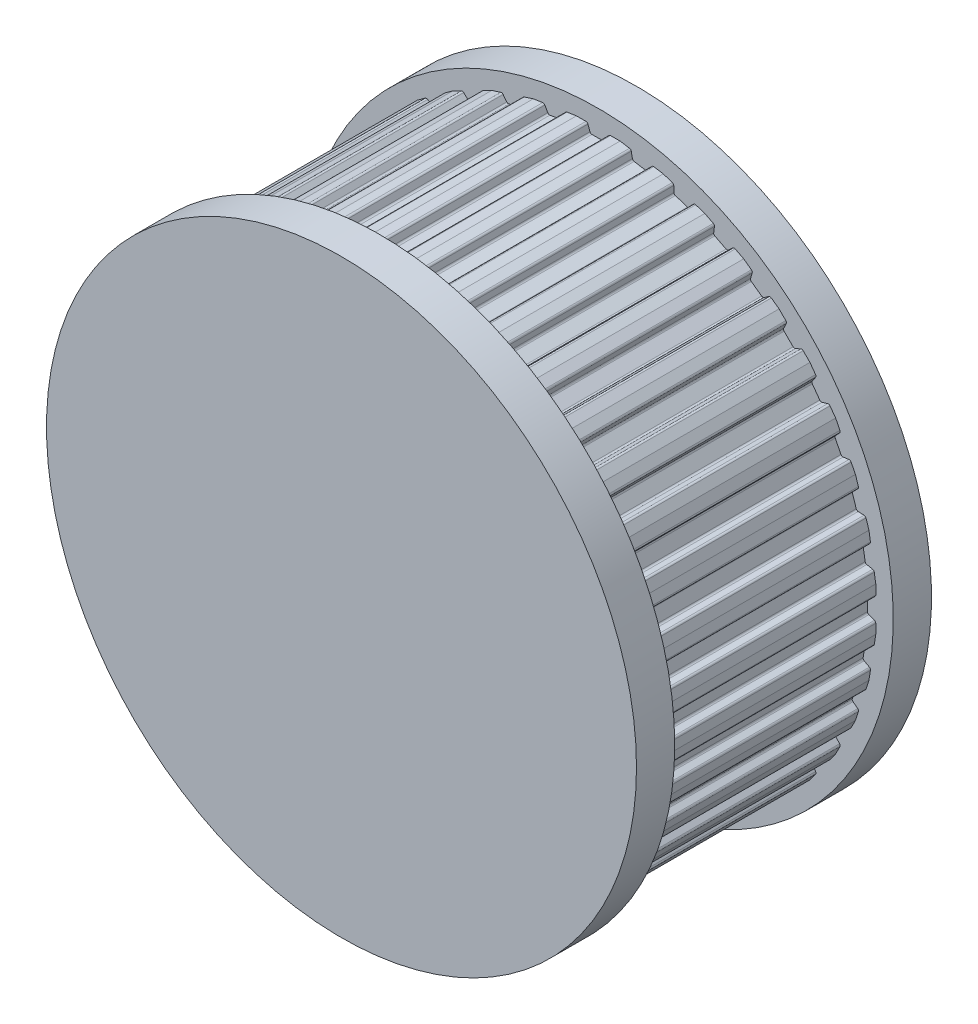
from build123d import *

# Parameters (mm, degrees)
BOSS_EXTRUDE1_DEPTH = 10
SKETCH3_R           = 13.5
BOSS_EXTRUDE2_DEPTH = 1.75
BOSS_EXTRUDE3_START = 1.75
SKETCH4_R           = 13.5
BOSS_EXTRUDE3_DEPTH = 1.75


with BuildPart() as part:
    # Sketch1 → Boss-Extrude1 (new body)
    with BuildSketch(Plane.XY):
        with BuildLine():
            Line((-50.783511677, 0), (-50.346633156, 0))
            ThreePointArc((-50.346633156, 0), (-50.292, 0.017225768), (-50.257127433, 0.062672581))
            Line((-50.257127433, 0.062672581), (-50.164076682, 0.318327419))
            ThreePointArc((-50.164076682, 0.318327419), (-50.129204116, 0.363774232), (-50.07457096, 0.381))
            Line((-50.07457096, 0.381), (-49.49342904, 0.381))
            ThreePointArc((-49.49342904, 0.381), (-49.438795884, 0.363774232), (-49.403923318, 0.318327419))
            Line((-49.403923318, 0.318327419), (-49.310872567, 0.062672581))
            ThreePointArc((-49.310872567, 0.062672581), (-49.276, 0.017225768), (-49.221366844, 0))
            Line((-49.221366844, 0), (-48.784488323, 0))
            Line((-48.784488323, 0), (-48.352988502, 0.068342858))
            ThreePointArc((-48.352988502, 0.068342858), (-48.301722675, 0.093903056), (-48.274388895, 0.144245615))
            Line((-48.274388895, 0.144245615), (-48.222476981, 0.411309262))
            ThreePointArc((-48.222476981, 0.411309262), (-48.195143202, 0.461651821), (-48.143877375, 0.487212019))
            Line((-48.143877375, 0.487212019), (-47.569890276, 0.578122645))
            ThreePointArc((-47.569890276, 0.578122645), (-47.513235041, 0.569655463), (-47.471682366, 0.530223447))
            Line((-47.471682366, 0.530223447), (-47.339783996, 0.292272489))
            ThreePointArc((-47.339783996, 0.292272489), (-47.298231321, 0.252840473), (-47.241576086, 0.244373291))
            Line((-47.241576086, 0.244373291), (-46.810076265, 0.312716149))
            Line((-46.810076265, 0.312716149), (-46.3945801, 0.447719036))
            ThreePointArc((-46.3945801, 0.447719036), (-46.347943937, 0.480984289), (-46.328821993, 0.534982993))
            Line((-46.328821993, 0.534982993), (-46.319327159, 0.806879455))
            ThreePointArc((-46.319327159, 0.806879455), (-46.300205215, 0.860878159), (-46.253569052, 0.894143411))
            Line((-46.253569052, 0.894143411), (-45.700870241, 1.073726141))
            ThreePointArc((-45.700870241, 1.073726141), (-45.643587967, 1.074226035), (-45.596378348, 1.041779763))
            Line((-45.596378348, 1.041779763), (-45.428880136, 0.827391827))
            ThreePointArc((-45.428880136, 0.827391827), (-45.381670516, 0.794945555), (-45.324388243, 0.79544545))
            Line((-45.324388243, 0.79544545), (-44.908892078, 0.930448337))
            Line((-44.908892078, 0.930448337), (-44.519630466, 1.128787035))
            ThreePointArc((-44.519630466, 1.128787035), (-44.478772303, 1.16893824), (-44.46833304, 1.225263462))
            Line((-44.46833304, 1.225263462), (-44.501489081, 1.495297747))
            ThreePointArc((-44.501489081, 1.495297747), (-44.491049818, 1.551622968), (-44.450191655, 1.591774173))
            Line((-44.450191655, 1.591774173), (-43.932390412, 1.855607084))
            ThreePointArc((-43.932390412, 1.855607084), (-43.875891579, 1.865061746), (-43.824187473, 1.840400153))
            Line((-43.824187473, 1.840400153), (-43.62521378, 1.654854182))
            ThreePointArc((-43.62521378, 1.654854182), (-43.573509674, 1.630192588), (-43.517010841, 1.63964725))
            Line((-43.517010841, 1.63964725), (-43.127749228, 1.837985948))
            Line((-43.127749228, 1.837985948), (-42.77430708, 2.0947767))
            ThreePointArc((-42.77430708, 2.0947767), (-42.740232981, 2.140825202), (-42.738733449, 2.198090027))
            Line((-42.738733449, 2.198090027), (-42.813723953, 2.459612994))
            ThreePointArc((-42.813723953, 2.459612994), (-42.812224421, 2.516877819), (-42.778150322, 2.562926321))
            Line((-42.778150322, 2.562926321), (-42.307996632, 2.904512971))
            ThreePointArc((-42.307996632, 2.904512971), (-42.253672429, 2.922689596), (-42.198746963, 2.906419932))
            Line((-42.198746963, 2.906419932), (-41.973197181, 2.754284683))
            ThreePointArc((-41.973197181, 2.754284683), (-41.918271715, 2.738015018), (-41.863947511, 2.756191643))
            Line((-41.863947511, 2.756191643), (-41.510505363, 3.012982394))
            Line((-41.510505363, 3.012982394), (-41.201585599, 3.321902159))
            ThreePointArc((-41.201585599, 3.321902159), (-41.175134581, 3.372714091), (-41.182611703, 3.42950847))
            Line((-41.182611703, 3.42950847), (-41.297590155, 3.676080556))
            ThreePointArc((-41.297590155, 3.676080556), (-41.305067277, 3.732874934), (-41.278616259, 3.783686866))
            Line((-41.278616259, 3.783686866), (-40.867686866, 4.194616259))
            ThreePointArc((-40.867686866, 4.194616259), (-40.816874934, 4.221067277), (-40.760080556, 4.213590155))
            Line((-40.760080556, 4.213590155), (-40.51350847, 4.098611703))
            ThreePointArc((-40.51350847, 4.098611703), (-40.456714091, 4.091134581), (-40.405902159, 4.117585599))
            Line((-40.405902159, 4.117585599), (-40.096982394, 4.426505363))
            Line((-40.096982394, 4.426505363), (-39.840191643, 4.779947511))
            ThreePointArc((-39.840191643, 4.779947511), (-39.822015018, 4.834271715), (-39.838284683, 4.889197181))
            Line((-39.838284683, 4.889197181), (-39.990419932, 5.114746963))
            ThreePointArc((-39.990419932, 5.114746963), (-40.006689596, 5.169672429), (-39.988512971, 5.223996632))
            Line((-39.988512971, 5.223996632), (-39.646926321, 5.694150322))
            ThreePointArc((-39.646926321, 5.694150322), (-39.600877819, 5.728224421), (-39.543612994, 5.729723953))
            Line((-39.543612994, 5.729723953), (-39.282090027, 5.654733449))
            ThreePointArc((-39.282090027, 5.654733449), (-39.224825202, 5.656232981), (-39.1787767, 5.69030708))
            Line((-39.1787767, 5.69030708), (-38.921985948, 6.043749228))
            Line((-38.921985948, 6.043749228), (-38.72364725, 6.433010841))
            ThreePointArc((-38.72364725, 6.433010841), (-38.714192588, 6.489509674), (-38.738854182, 6.54121378))
            Line((-38.738854182, 6.54121378), (-38.924400153, 6.740187473))
            ThreePointArc((-38.924400153, 6.740187473), (-38.949061746, 6.791891579), (-38.939607084, 6.848390412))
            Line((-38.939607084, 6.848390412), (-38.675774173, 7.366191655))
            ThreePointArc((-38.675774173, 7.366191655), (-38.635622968, 7.407049818), (-38.579297747, 7.417489081))
            Line((-38.579297747, 7.417489081), (-38.309263462, 7.38433304))
            ThreePointArc((-38.309263462, 7.38433304), (-38.25293824, 7.394772303), (-38.212787035, 7.435630466))
            Line((-38.212787035, 7.435630466), (-38.014448337, 7.824892078))
            Line((-38.014448337, 7.824892078), (-37.87944545, 8.240388243))
            ThreePointArc((-37.87944545, 8.240388243), (-37.878945555, 8.297670516), (-37.911391827, 8.344880136))
            Line((-37.911391827, 8.344880136), (-38.125779763, 8.512378348))
            ThreePointArc((-38.125779763, 8.512378348), (-38.158226035, 8.559587967), (-38.157726141, 8.616870241))
            Line((-38.157726141, 8.616870241), (-37.978143411, 9.169569052))
            ThreePointArc((-37.978143411, 9.169569052), (-37.944878159, 9.216205215), (-37.890879455, 9.235327159))
            Line((-37.890879455, 9.235327159), (-37.618982993, 9.244821993))
            ThreePointArc((-37.618982993, 9.244821993), (-37.564984289, 9.263943937), (-37.531719036, 9.3105801))
            Line((-37.531719036, 9.3105801), (-37.396716149, 9.726076265))
            Line((-37.396716149, 9.726076265), (-37.328373291, 10.157576086))
            ThreePointArc((-37.328373291, 10.157576086), (-37.336840473, 10.214231321), (-37.376272489, 10.255783996))
            Line((-37.376272489, 10.255783996), (-37.614223447, 10.387682366))
            ThreePointArc((-37.614223447, 10.387682366), (-37.653655463, 10.429235041), (-37.662122645, 10.485890276))
            Line((-37.662122645, 10.485890276), (-37.571212019, 11.059877375))
            ThreePointArc((-37.571212019, 11.059877375), (-37.545651821, 11.111143202), (-37.495309262, 11.138476981))
            Line((-37.495309262, 11.138476981), (-37.228245615, 11.190388895))
            ThreePointArc((-37.228245615, 11.190388895), (-37.177903056, 11.217722675), (-37.152342858, 11.268988502))
            Line((-37.152342858, 11.268988502), (-37.084, 11.700488323))
            Line((-37.084, 11.700488323), (-37.084, 12.137366844))
            ThreePointArc((-37.084, 12.137366844), (-37.101225768, 12.192), (-37.146672581, 12.226872567))
            Line((-37.146672581, 12.226872567), (-37.402327419, 12.319923318))
            ThreePointArc((-37.402327419, 12.319923318), (-37.447774232, 12.354795884), (-37.465, 12.40942904))
            Line((-37.465, 12.40942904), (-37.465, 12.99057096))
            ThreePointArc((-37.465, 12.99057096), (-37.447774232, 13.045204116), (-37.402327419, 13.080076682))
            Line((-37.402327419, 13.080076682), (-37.146672581, 13.173127433))
            ThreePointArc((-37.146672581, 13.173127433), (-37.101225768, 13.208), (-37.084, 13.262633156))
            Line((-37.084, 13.262633156), (-37.084, 13.699511677))
            Line((-37.084, 13.699511677), (-37.152342858, 14.131011498))
            ThreePointArc((-37.152342858, 14.131011498), (-37.177903056, 14.182277325), (-37.228245615, 14.209611105))
            Line((-37.228245615, 14.209611105), (-37.495309262, 14.261523019))
            ThreePointArc((-37.495309262, 14.261523019), (-37.545651821, 14.288856798), (-37.571212019, 14.340122625))
            Line((-37.571212019, 14.340122625), (-37.662122645, 14.914109724))
            ThreePointArc((-37.662122645, 14.914109724), (-37.653655463, 14.970764959), (-37.614223447, 15.012317634))
            Line((-37.614223447, 15.012317634), (-37.376272489, 15.144216004))
            ThreePointArc((-37.376272489, 15.144216004), (-37.336840473, 15.185768679), (-37.328373291, 15.242423914))
            Line((-37.328373291, 15.242423914), (-37.396716149, 15.673923735))
            Line((-37.396716149, 15.673923735), (-37.531719036, 16.0894199))
            ThreePointArc((-37.531719036, 16.0894199), (-37.564984289, 16.136056063), (-37.618982993, 16.155178007))
            Line((-37.618982993, 16.155178007), (-37.890879455, 16.164672841))
            ThreePointArc((-37.890879455, 16.164672841), (-37.944878159, 16.183794785), (-37.978143411, 16.230430948))
            Line((-37.978143411, 16.230430948), (-38.157726141, 16.783129759))
            ThreePointArc((-38.157726141, 16.783129759), (-38.158226035, 16.840412033), (-38.125779763, 16.887621652))
            Line((-38.125779763, 16.887621652), (-37.911391827, 17.055119864))
            ThreePointArc((-37.911391827, 17.055119864), (-37.878945555, 17.102329484), (-37.87944545, 17.159611757))
            Line((-37.87944545, 17.159611757), (-38.014448337, 17.575107922))
            Line((-38.014448337, 17.575107922), (-38.212787035, 17.964369534))
            ThreePointArc((-38.212787035, 17.964369534), (-38.25293824, 18.005227697), (-38.309263462, 18.01566696))
            Line((-38.309263462, 18.01566696), (-38.579297747, 17.982510919))
            ThreePointArc((-38.579297747, 17.982510919), (-38.635622968, 17.992950182), (-38.675774173, 18.033808345))
            Line((-38.675774173, 18.033808345), (-38.939607084, 18.551609588))
            ThreePointArc((-38.939607084, 18.551609588), (-38.949061746, 18.608108421), (-38.924400153, 18.659812527))
            Line((-38.924400153, 18.659812527), (-38.738854182, 18.85878622))
            ThreePointArc((-38.738854182, 18.85878622), (-38.714192588, 18.910490326), (-38.72364725, 18.966989159))
            Line((-38.72364725, 18.966989159), (-38.921985948, 19.356250772))
            Line((-38.921985948, 19.356250772), (-39.1787767, 19.70969292))
            ThreePointArc((-39.1787767, 19.70969292), (-39.224825202, 19.743767019), (-39.282090027, 19.745266551))
            Line((-39.282090027, 19.745266551), (-39.543612994, 19.670276047))
            ThreePointArc((-39.543612994, 19.670276047), (-39.600877819, 19.671775579), (-39.646926321, 19.705849678))
            Line((-39.646926321, 19.705849678), (-39.988512971, 20.176003368))
            ThreePointArc((-39.988512971, 20.176003368), (-40.006689596, 20.230327571), (-39.990419932, 20.285253037))
            Line((-39.990419932, 20.285253037), (-39.838284683, 20.510802819))
            ThreePointArc((-39.838284683, 20.510802819), (-39.822015018, 20.565728285), (-39.840191643, 20.620052489))
            Line((-39.840191643, 20.620052489), (-40.096982394, 20.973494637))
            Line((-40.096982394, 20.973494637), (-40.405902159, 21.282414401))
            ThreePointArc((-40.405902159, 21.282414401), (-40.456714091, 21.308865419), (-40.51350847, 21.301388297))
            Line((-40.51350847, 21.301388297), (-40.760080556, 21.186409845))
            ThreePointArc((-40.760080556, 21.186409845), (-40.816874934, 21.178932723), (-40.867686866, 21.205383741))
            Line((-40.867686866, 21.205383741), (-41.278616259, 21.616313134))
            ThreePointArc((-41.278616259, 21.616313134), (-41.305067277, 21.667125066), (-41.297590155, 21.723919444))
            Line((-41.297590155, 21.723919444), (-41.182611703, 21.97049153))
            ThreePointArc((-41.182611703, 21.97049153), (-41.175134581, 22.027285909), (-41.201585599, 22.078097841))
            Line((-41.201585599, 22.078097841), (-41.510505363, 22.387017606))
            Line((-41.510505363, 22.387017606), (-41.863947511, 22.643808357))
            ThreePointArc((-41.863947511, 22.643808357), (-41.918271715, 22.661984982), (-41.973197181, 22.645715317))
            Line((-41.973197181, 22.645715317), (-42.198746963, 22.493580068))
            ThreePointArc((-42.198746963, 22.493580068), (-42.253672429, 22.477310404), (-42.307996632, 22.495487029))
            Line((-42.307996632, 22.495487029), (-42.778150322, 22.837073679))
            ThreePointArc((-42.778150322, 22.837073679), (-42.812224421, 22.883122181), (-42.813723953, 22.940387006))
            Line((-42.813723953, 22.940387006), (-42.738733449, 23.201909973))
            ThreePointArc((-42.738733449, 23.201909973), (-42.740232981, 23.259174798), (-42.77430708, 23.3052233))
            Line((-42.77430708, 23.3052233), (-43.127749228, 23.562014052))
            Line((-43.127749228, 23.562014052), (-43.517010841, 23.76035275))
            ThreePointArc((-43.517010841, 23.76035275), (-43.573509674, 23.769807412), (-43.62521378, 23.745145818))
            Line((-43.62521378, 23.745145818), (-43.824187473, 23.559599847))
            ThreePointArc((-43.824187473, 23.559599847), (-43.875891579, 23.534938254), (-43.932390412, 23.544392916))
            Line((-43.932390412, 23.544392916), (-44.450191655, 23.808225827))
            ThreePointArc((-44.450191655, 23.808225827), (-44.491049818, 23.848377032), (-44.501489081, 23.904702253))
            Line((-44.501489081, 23.904702253), (-44.46833304, 24.174736538))
            ThreePointArc((-44.46833304, 24.174736538), (-44.478772303, 24.23106176), (-44.519630466, 24.271212965))
            Line((-44.519630466, 24.271212965), (-44.908892078, 24.469551663))
            Line((-44.908892078, 24.469551663), (-45.324388243, 24.60455455))
            ThreePointArc((-45.324388243, 24.60455455), (-45.381670516, 24.605054445), (-45.428880136, 24.572608173))
            Line((-45.428880136, 24.572608173), (-45.596378348, 24.358220237))
            ThreePointArc((-45.596378348, 24.358220237), (-45.643587967, 24.325773965), (-45.700870241, 24.326273859))
            Line((-45.700870241, 24.326273859), (-46.253569052, 24.505856589))
            ThreePointArc((-46.253569052, 24.505856589), (-46.300205215, 24.539121841), (-46.319327159, 24.593120545))
            Line((-46.319327159, 24.593120545), (-46.328821993, 24.865017007))
            ThreePointArc((-46.328821993, 24.865017007), (-46.347943937, 24.919015711), (-46.3945801, 24.952280964))
            Line((-46.3945801, 24.952280964), (-46.810076265, 25.087283851))
            Line((-46.810076265, 25.087283851), (-47.241576086, 25.155626709))
            ThreePointArc((-47.241576086, 25.155626709), (-47.298231321, 25.147159527), (-47.339783996, 25.107727511))
            Line((-47.339783996, 25.107727511), (-47.471682366, 24.869776553))
            ThreePointArc((-47.471682366, 24.869776553), (-47.513235041, 24.830344537), (-47.569890276, 24.821877355))
            Line((-47.569890276, 24.821877355), (-48.143877375, 24.912787981))
            ThreePointArc((-48.143877375, 24.912787981), (-48.195143202, 24.938348179), (-48.222476981, 24.988690738))
            Line((-48.222476981, 24.988690738), (-48.274388895, 25.255754385))
            ThreePointArc((-48.274388895, 25.255754385), (-48.301722675, 25.306096944), (-48.352988502, 25.331657142))
            Line((-48.352988502, 25.331657142), (-48.784488323, 25.4))
            Line((-48.784488323, 25.4), (-49.221366844, 25.4))
            ThreePointArc((-49.221366844, 25.4), (-49.276, 25.382774232), (-49.310872567, 25.337327419))
            Line((-49.310872567, 25.337327419), (-49.403923318, 25.081672581))
            ThreePointArc((-49.403923318, 25.081672581), (-49.438795884, 25.036225768), (-49.49342904, 25.019))
            Line((-49.49342904, 25.019), (-50.07457096, 25.019))
            ThreePointArc((-50.07457096, 25.019), (-50.129204116, 25.036225768), (-50.164076682, 25.081672581))
            Line((-50.164076682, 25.081672581), (-50.257127433, 25.337327419))
            ThreePointArc((-50.257127433, 25.337327419), (-50.292, 25.382774232), (-50.346633156, 25.4))
            Line((-50.346633156, 25.4), (-50.783511677, 25.4))
            Line((-50.783511677, 25.4), (-51.215011498, 25.331657142))
            ThreePointArc((-51.215011498, 25.331657142), (-51.266277325, 25.306096944), (-51.293611105, 25.255754385))
            Line((-51.293611105, 25.255754385), (-51.345523019, 24.988690738))
            ThreePointArc((-51.345523019, 24.988690738), (-51.372856798, 24.938348179), (-51.424122625, 24.912787981))
            Line((-51.424122625, 24.912787981), (-51.998109724, 24.821877355))
            ThreePointArc((-51.998109724, 24.821877355), (-52.054764959, 24.830344537), (-52.096317634, 24.869776553))
            Line((-52.096317634, 24.869776553), (-52.228216004, 25.107727511))
            ThreePointArc((-52.228216004, 25.107727511), (-52.269768679, 25.147159527), (-52.326423914, 25.155626709))
            Line((-52.326423914, 25.155626709), (-52.757923735, 25.087283851))
            Line((-52.757923735, 25.087283851), (-53.1734199, 24.952280964))
            ThreePointArc((-53.1734199, 24.952280964), (-53.220056063, 24.919015711), (-53.239178007, 24.865017007))
            Line((-53.239178007, 24.865017007), (-53.248672841, 24.593120545))
            ThreePointArc((-53.248672841, 24.593120545), (-53.267794785, 24.539121841), (-53.314430948, 24.505856589))
            Line((-53.314430948, 24.505856589), (-53.867129759, 24.326273859))
            ThreePointArc((-53.867129759, 24.326273859), (-53.924412033, 24.325773965), (-53.971621652, 24.358220237))
            Line((-53.971621652, 24.358220237), (-54.139119864, 24.572608173))
            ThreePointArc((-54.139119864, 24.572608173), (-54.186329484, 24.605054445), (-54.243611757, 24.60455455))
            Line((-54.243611757, 24.60455455), (-54.659107922, 24.469551663))
            Line((-54.659107922, 24.469551663), (-55.048369534, 24.271212965))
            ThreePointArc((-55.048369534, 24.271212965), (-55.089227697, 24.23106176), (-55.09966696, 24.174736538))
            Line((-55.09966696, 24.174736538), (-55.066510919, 23.904702253))
            ThreePointArc((-55.066510919, 23.904702253), (-55.076950182, 23.848377032), (-55.117808345, 23.808225827))
            Line((-55.117808345, 23.808225827), (-55.635609588, 23.544392916))
            ThreePointArc((-55.635609588, 23.544392916), (-55.692108421, 23.534938254), (-55.743812527, 23.559599847))
            Line((-55.743812527, 23.559599847), (-55.94278622, 23.745145818))
            ThreePointArc((-55.94278622, 23.745145818), (-55.994490326, 23.769807412), (-56.050989159, 23.76035275))
            Line((-56.050989159, 23.76035275), (-56.440250772, 23.562014052))
            Line((-56.440250772, 23.562014052), (-56.79369292, 23.3052233))
            ThreePointArc((-56.79369292, 23.3052233), (-56.827767019, 23.259174798), (-56.829266551, 23.201909973))
            Line((-56.829266551, 23.201909973), (-56.754276047, 22.940387006))
            ThreePointArc((-56.754276047, 22.940387006), (-56.755775579, 22.883122181), (-56.789849678, 22.837073679))
            Line((-56.789849678, 22.837073679), (-57.260003368, 22.495487029))
            ThreePointArc((-57.260003368, 22.495487029), (-57.314327571, 22.477310404), (-57.369253037, 22.493580068))
            Line((-57.369253037, 22.493580068), (-57.594802819, 22.645715317))
            ThreePointArc((-57.594802819, 22.645715317), (-57.649728285, 22.661984982), (-57.704052489, 22.643808357))
            Line((-57.704052489, 22.643808357), (-58.057494637, 22.387017606))
            Line((-58.057494637, 22.387017606), (-58.366414401, 22.078097841))
            ThreePointArc((-58.366414401, 22.078097841), (-58.392865419, 22.027285909), (-58.385388297, 21.97049153))
            Line((-58.385388297, 21.97049153), (-58.270409845, 21.723919444))
            ThreePointArc((-58.270409845, 21.723919444), (-58.262932723, 21.667125066), (-58.289383741, 21.616313134))
            Line((-58.289383741, 21.616313134), (-58.700313134, 21.205383741))
            ThreePointArc((-58.700313134, 21.205383741), (-58.751125066, 21.178932723), (-58.807919444, 21.186409845))
            Line((-58.807919444, 21.186409845), (-59.05449153, 21.301388297))
            ThreePointArc((-59.05449153, 21.301388297), (-59.111285909, 21.308865419), (-59.162097841, 21.282414401))
            Line((-59.162097841, 21.282414401), (-59.471017606, 20.973494637))
            Line((-59.471017606, 20.973494637), (-59.727808357, 20.620052489))
            ThreePointArc((-59.727808357, 20.620052489), (-59.745984982, 20.565728285), (-59.729715317, 20.510802819))
            Line((-59.729715317, 20.510802819), (-59.577580068, 20.285253037))
            ThreePointArc((-59.577580068, 20.285253037), (-59.561310404, 20.230327571), (-59.579487029, 20.176003368))
            Line((-59.579487029, 20.176003368), (-59.921073679, 19.705849678))
            ThreePointArc((-59.921073679, 19.705849678), (-59.967122181, 19.671775579), (-60.024387006, 19.670276047))
            Line((-60.024387006, 19.670276047), (-60.285909973, 19.745266551))
            ThreePointArc((-60.285909973, 19.745266551), (-60.343174798, 19.743767019), (-60.3892233, 19.70969292))
            Line((-60.3892233, 19.70969292), (-60.646014052, 19.356250772))
            Line((-60.646014052, 19.356250772), (-60.84435275, 18.966989159))
            ThreePointArc((-60.84435275, 18.966989159), (-60.853807412, 18.910490326), (-60.829145818, 18.85878622))
            Line((-60.829145818, 18.85878622), (-60.643599847, 18.659812527))
            ThreePointArc((-60.643599847, 18.659812527), (-60.618938254, 18.608108421), (-60.628392916, 18.551609588))
            Line((-60.628392916, 18.551609588), (-60.892225827, 18.033808345))
            ThreePointArc((-60.892225827, 18.033808345), (-60.932377032, 17.992950182), (-60.988702253, 17.982510919))
            Line((-60.988702253, 17.982510919), (-61.258736538, 18.01566696))
            ThreePointArc((-61.258736538, 18.01566696), (-61.31506176, 18.005227697), (-61.355212965, 17.964369534))
            Line((-61.355212965, 17.964369534), (-61.553551663, 17.575107922))
            Line((-61.553551663, 17.575107922), (-61.68855455, 17.159611757))
            ThreePointArc((-61.68855455, 17.159611757), (-61.689054445, 17.102329484), (-61.656608173, 17.055119864))
            Line((-61.656608173, 17.055119864), (-61.442220237, 16.887621652))
            ThreePointArc((-61.442220237, 16.887621652), (-61.409773965, 16.840412033), (-61.410273859, 16.783129759))
            Line((-61.410273859, 16.783129759), (-61.589856589, 16.230430948))
            ThreePointArc((-61.589856589, 16.230430948), (-61.623121841, 16.183794785), (-61.677120545, 16.164672841))
            Line((-61.677120545, 16.164672841), (-61.949017007, 16.155178007))
            ThreePointArc((-61.949017007, 16.155178007), (-62.003015711, 16.136056063), (-62.036280964, 16.0894199))
            Line((-62.036280964, 16.0894199), (-62.171283851, 15.673923735))
            Line((-62.171283851, 15.673923735), (-62.239626709, 15.242423914))
            ThreePointArc((-62.239626709, 15.242423914), (-62.231159527, 15.185768679), (-62.191727511, 15.144216004))
            Line((-62.191727511, 15.144216004), (-61.953776553, 15.012317634))
            ThreePointArc((-61.953776553, 15.012317634), (-61.914344537, 14.970764959), (-61.905877355, 14.914109724))
            Line((-61.905877355, 14.914109724), (-61.996787981, 14.340122625))
            ThreePointArc((-61.996787981, 14.340122625), (-62.022348179, 14.288856798), (-62.072690738, 14.261523019))
            Line((-62.072690738, 14.261523019), (-62.339754385, 14.209611105))
            ThreePointArc((-62.339754385, 14.209611105), (-62.390096944, 14.182277325), (-62.415657142, 14.131011498))
            Line((-62.415657142, 14.131011498), (-62.484, 13.699511677))
            Line((-62.484, 13.699511677), (-62.484, 13.262633156))
            ThreePointArc((-62.484, 13.262633156), (-62.466774232, 13.208), (-62.421327419, 13.173127433))
            Line((-62.421327419, 13.173127433), (-62.165672581, 13.080076682))
            ThreePointArc((-62.165672581, 13.080076682), (-62.120225768, 13.045204116), (-62.103, 12.99057096))
            Line((-62.103, 12.99057096), (-62.103, 12.40942904))
            ThreePointArc((-62.103, 12.40942904), (-62.120225768, 12.354795884), (-62.165672581, 12.319923318))
            Line((-62.165672581, 12.319923318), (-62.421327419, 12.226872567))
            ThreePointArc((-62.421327419, 12.226872567), (-62.466774232, 12.192), (-62.484, 12.137366844))
            Line((-62.484, 12.137366844), (-62.484, 11.700488323))
            Line((-62.484, 11.700488323), (-62.415657142, 11.268988502))
            ThreePointArc((-62.415657142, 11.268988502), (-62.390096944, 11.217722675), (-62.339754385, 11.190388895))
            Line((-62.339754385, 11.190388895), (-62.072690738, 11.138476981))
            ThreePointArc((-62.072690738, 11.138476981), (-62.022348179, 11.111143202), (-61.996787981, 11.059877375))
            Line((-61.996787981, 11.059877375), (-61.905877355, 10.485890276))
            ThreePointArc((-61.905877355, 10.485890276), (-61.914344537, 10.429235041), (-61.953776553, 10.387682366))
            Line((-61.953776553, 10.387682366), (-62.191727511, 10.255783996))
            ThreePointArc((-62.191727511, 10.255783996), (-62.231159527, 10.214231321), (-62.239626709, 10.157576086))
            Line((-62.239626709, 10.157576086), (-62.171283851, 9.726076265))
            Line((-62.171283851, 9.726076265), (-62.036280964, 9.3105801))
            ThreePointArc((-62.036280964, 9.3105801), (-62.003015711, 9.263943937), (-61.949017007, 9.244821993))
            Line((-61.949017007, 9.244821993), (-61.677120545, 9.235327159))
            ThreePointArc((-61.677120545, 9.235327159), (-61.623121841, 9.216205215), (-61.589856589, 9.169569052))
            Line((-61.589856589, 9.169569052), (-61.410273859, 8.616870241))
            ThreePointArc((-61.410273859, 8.616870241), (-61.409773965, 8.559587967), (-61.442220237, 8.512378348))
            Line((-61.442220237, 8.512378348), (-61.656608173, 8.344880136))
            ThreePointArc((-61.656608173, 8.344880136), (-61.689054445, 8.297670516), (-61.68855455, 8.240388243))
            Line((-61.68855455, 8.240388243), (-61.553551663, 7.824892078))
            Line((-61.553551663, 7.824892078), (-61.355212965, 7.435630466))
            ThreePointArc((-61.355212965, 7.435630466), (-61.31506176, 7.394772303), (-61.258736538, 7.38433304))
            Line((-61.258736538, 7.38433304), (-60.988702253, 7.417489081))
            ThreePointArc((-60.988702253, 7.417489081), (-60.932377032, 7.407049818), (-60.892225827, 7.366191655))
            Line((-60.892225827, 7.366191655), (-60.628392916, 6.848390412))
            ThreePointArc((-60.628392916, 6.848390412), (-60.618938254, 6.791891579), (-60.643599847, 6.740187473))
            Line((-60.643599847, 6.740187473), (-60.829145818, 6.54121378))
            ThreePointArc((-60.829145818, 6.54121378), (-60.853807412, 6.489509674), (-60.84435275, 6.433010841))
            Line((-60.84435275, 6.433010841), (-60.646014052, 6.043749228))
            Line((-60.646014052, 6.043749228), (-60.3892233, 5.69030708))
            ThreePointArc((-60.3892233, 5.69030708), (-60.343174798, 5.656232981), (-60.285909973, 5.654733449))
            Line((-60.285909973, 5.654733449), (-60.024387006, 5.729723953))
            ThreePointArc((-60.024387006, 5.729723953), (-59.967122181, 5.728224421), (-59.921073679, 5.694150322))
            Line((-59.921073679, 5.694150322), (-59.579487029, 5.223996632))
            ThreePointArc((-59.579487029, 5.223996632), (-59.561310404, 5.169672429), (-59.577580068, 5.114746963))
            Line((-59.577580068, 5.114746963), (-59.729715317, 4.889197181))
            ThreePointArc((-59.729715317, 4.889197181), (-59.745984982, 4.834271715), (-59.727808357, 4.779947511))
            Line((-59.727808357, 4.779947511), (-59.471017606, 4.426505363))
            Line((-59.471017606, 4.426505363), (-59.162097841, 4.117585599))
            ThreePointArc((-59.162097841, 4.117585599), (-59.111285909, 4.091134581), (-59.05449153, 4.098611703))
            Line((-59.05449153, 4.098611703), (-58.807919444, 4.213590155))
            ThreePointArc((-58.807919444, 4.213590155), (-58.751125066, 4.221067277), (-58.700313134, 4.194616259))
            Line((-58.700313134, 4.194616259), (-58.289383741, 3.783686866))
            ThreePointArc((-58.289383741, 3.783686866), (-58.262932723, 3.732874934), (-58.270409845, 3.676080556))
            Line((-58.270409845, 3.676080556), (-58.385388297, 3.42950847))
            ThreePointArc((-58.385388297, 3.42950847), (-58.392865419, 3.372714091), (-58.366414401, 3.321902159))
            Line((-58.366414401, 3.321902159), (-58.057494637, 3.012982394))
            Line((-58.057494637, 3.012982394), (-57.704052489, 2.756191643))
            ThreePointArc((-57.704052489, 2.756191643), (-57.649728285, 2.738015018), (-57.594802819, 2.754284683))
            Line((-57.594802819, 2.754284683), (-57.369253037, 2.906419932))
            ThreePointArc((-57.369253037, 2.906419932), (-57.314327571, 2.922689596), (-57.260003368, 2.904512971))
            Line((-57.260003368, 2.904512971), (-56.789849678, 2.562926321))
            ThreePointArc((-56.789849678, 2.562926321), (-56.755775579, 2.516877819), (-56.754276047, 2.459612994))
            Line((-56.754276047, 2.459612994), (-56.829266551, 2.198090027))
            ThreePointArc((-56.829266551, 2.198090027), (-56.827767019, 2.140825202), (-56.79369292, 2.0947767))
            Line((-56.79369292, 2.0947767), (-56.440250772, 1.837985948))
            Line((-56.440250772, 1.837985948), (-56.050989159, 1.63964725))
            ThreePointArc((-56.050989159, 1.63964725), (-55.994490326, 1.630192588), (-55.94278622, 1.654854182))
            Line((-55.94278622, 1.654854182), (-55.743812527, 1.840400153))
            ThreePointArc((-55.743812527, 1.840400153), (-55.692108421, 1.865061746), (-55.635609588, 1.855607084))
            Line((-55.635609588, 1.855607084), (-55.117808345, 1.591774173))
            ThreePointArc((-55.117808345, 1.591774173), (-55.076950182, 1.551622968), (-55.066510919, 1.495297747))
            Line((-55.066510919, 1.495297747), (-55.09966696, 1.225263462))
            ThreePointArc((-55.09966696, 1.225263462), (-55.089227697, 1.16893824), (-55.048369534, 1.128787035))
            Line((-55.048369534, 1.128787035), (-54.659107922, 0.930448337))
            Line((-54.659107922, 0.930448337), (-54.243611757, 0.79544545))
            ThreePointArc((-54.243611757, 0.79544545), (-54.186329484, 0.794945555), (-54.139119864, 0.827391827))
            Line((-54.139119864, 0.827391827), (-53.971621652, 1.041779763))
            ThreePointArc((-53.971621652, 1.041779763), (-53.924412033, 1.074226035), (-53.867129759, 1.073726141))
            Line((-53.867129759, 1.073726141), (-53.314430948, 0.894143411))
            ThreePointArc((-53.314430948, 0.894143411), (-53.267794785, 0.860878159), (-53.248672841, 0.806879455))
            Line((-53.248672841, 0.806879455), (-53.239178007, 0.534982993))
            ThreePointArc((-53.239178007, 0.534982993), (-53.220056063, 0.480984289), (-53.1734199, 0.447719036))
            Line((-53.1734199, 0.447719036), (-52.757923735, 0.312716149))
            Line((-52.757923735, 0.312716149), (-52.326423914, 0.244373291))
            ThreePointArc((-52.326423914, 0.244373291), (-52.269768679, 0.252840473), (-52.228216004, 0.292272489))
            Line((-52.228216004, 0.292272489), (-52.096317634, 0.530223447))
            ThreePointArc((-52.096317634, 0.530223447), (-52.054764959, 0.569655463), (-51.998109724, 0.578122645))
            Line((-51.998109724, 0.578122645), (-51.424122625, 0.487212019))
            ThreePointArc((-51.424122625, 0.487212019), (-51.372856798, 0.461651821), (-51.345523019, 0.411309262))
            Line((-51.345523019, 0.411309262), (-51.293611105, 0.144245615))
            ThreePointArc((-51.293611105, 0.144245615), (-51.266277325, 0.093903056), (-51.215011498, 0.068342858))
            Line((-51.215011498, 0.068342858), (-50.783511677, 0))
        make_face()
    extrude(amount=BOSS_EXTRUDE1_DEPTH)

    # Sketch3 → Boss-Extrude2 (add)
    with BuildSketch(Plane.XY.offset(10)):
        with Locations((-49.784, 12.7)):
            Circle(SKETCH3_R)
    extrude(amount=BOSS_EXTRUDE2_DEPTH)

    # Sketch4 → Boss-Extrude3 (add)
    with BuildSketch(Plane(origin=(0, 0, 0), x_dir=(-1, 0, 0), z_dir=(0, 0, -1)).offset(BOSS_EXTRUDE3_START)):
        with Locations(Location((49.784, 12.7, 0), (0, 0, 180))):
            Circle(SKETCH4_R)
    extrude(amount=-BOSS_EXTRUDE3_DEPTH)


solid = part.part
